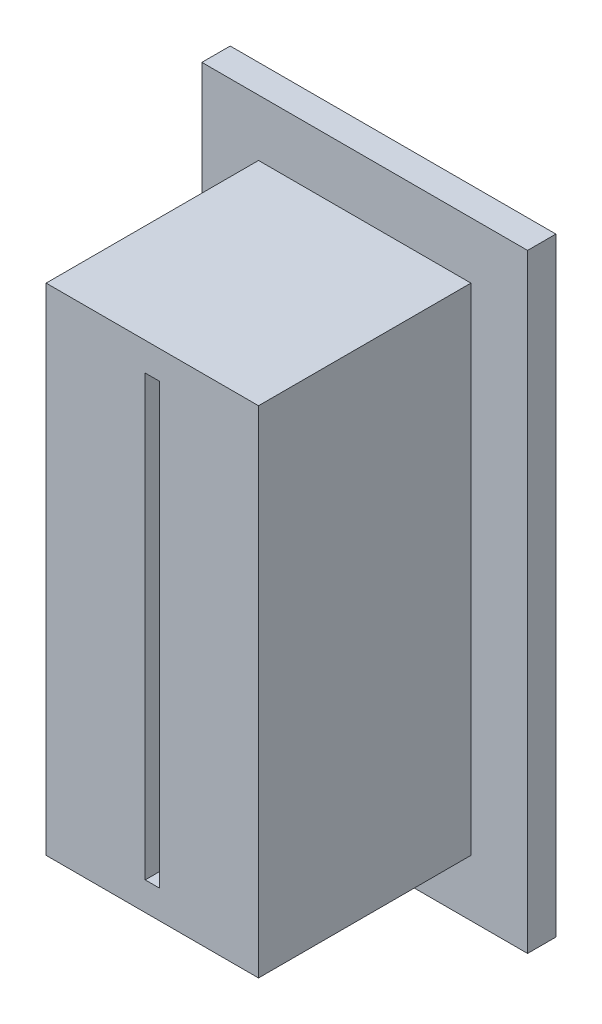
from build123d import *

# Parameters (mm, degrees)
SKETCH1_W           = 15
SKETCH1_H           = 35
BOSS_EXTRUDE1_DEPTH = 15
SKETCH3_W           = 12
SKETCH3_H           = 32
CUT_EXTRUDE2_DEPTH  = 13.5
SKETCH4_W           = 23
SKETCH4_H           = 43
SKETCH4_W_2         = 12
SKETCH4_H_2         = 32
BOSS_EXTRUDE2_DEPTH = 2
SKETCH5_W           = 1
SKETCH5_H           = 31
CUT_EXTRUDE3_DEPTH  = 2


with BuildPart() as part:
    # Sketch1 → Boss-Extrude1 (new body)
    with BuildSketch(Plane.XY):
        Rectangle(SKETCH1_W, SKETCH1_H)
    extrude(amount=BOSS_EXTRUDE1_DEPTH)

    # Sketch3 → Cut-Extrude2 (cut)
    with BuildSketch(Plane(origin=(0, 0, 0), x_dir=(-1, 0, 0), z_dir=(0, 0, -1))):
        Rectangle(SKETCH3_W, SKETCH3_H)
    extrude(amount=-CUT_EXTRUDE2_DEPTH, mode=Mode.SUBTRACT)

    # Sketch4 → Boss-Extrude2 (add)
    with BuildSketch(Plane(origin=(0, 0, 0), x_dir=(-1, 0, 0), z_dir=(0, 0, -1))):
        Rectangle(SKETCH4_W, SKETCH4_H)
        Rectangle(SKETCH4_W_2, SKETCH4_H_2, mode=Mode.SUBTRACT)
    extrude(amount=BOSS_EXTRUDE2_DEPTH)

    # Sketch5 → Cut-Extrude3 (cut)
    with BuildSketch(Plane.XY.offset(15)):
        Rectangle(SKETCH5_W, SKETCH5_H)
    extrude(amount=-CUT_EXTRUDE3_DEPTH, mode=Mode.SUBTRACT)


solid = part.part
